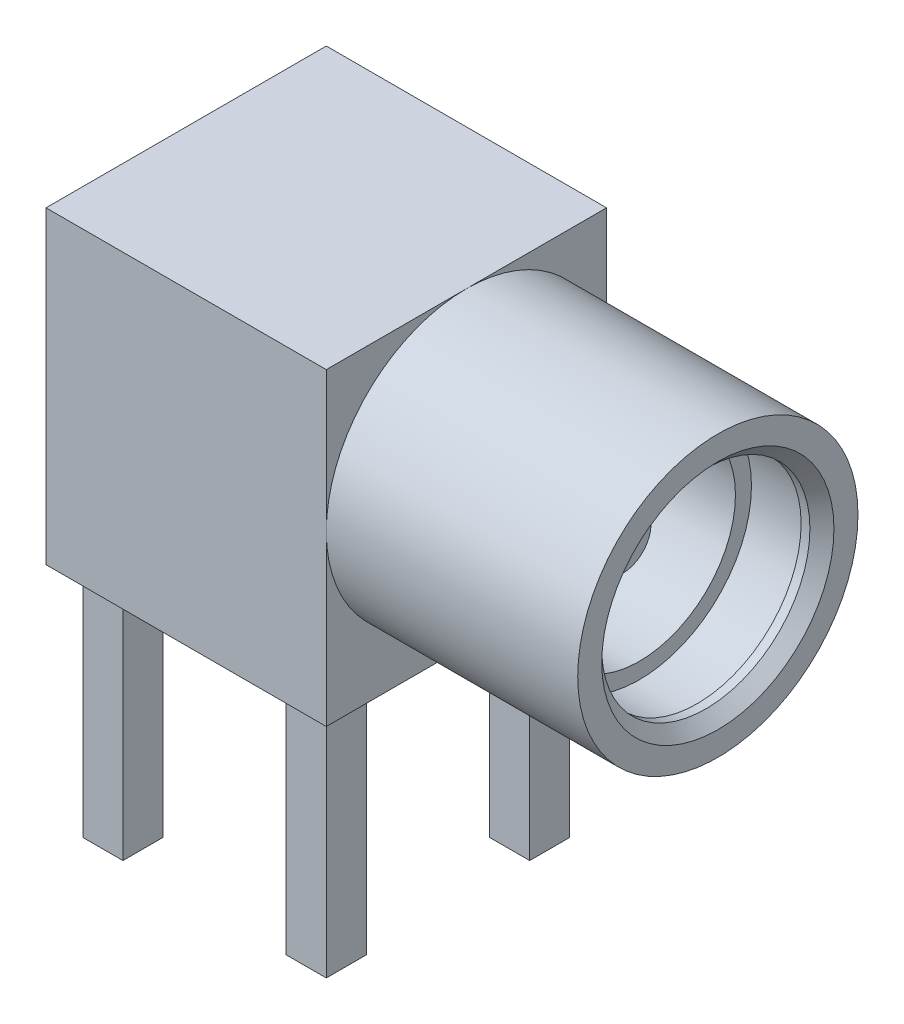
from build123d import *

# Parameters (mm, degrees)
SKETCH1_W                 = 3.5
SKETCH1_H                 = 3.86
BOSS_EXTRUDE1_DEPTH       = 3.5
SKETCH2_R                 = 1.75
BOSS_EXTRUDE2_DEPTH       = 3.14
SKETCH3_W                 = 0.5
SKETCH3_H                 = 0.5
BOSS_EXTRUDE3_DEPTH       = 2.95
SKETCH4_W                 = 0.5
SKETCH4_H                 = 0.5
BOSS_EXTRUDE4_DEPTH       = 2.95
SKETCH5_W                 = 0.5
SKETCH5_H                 = 0.5
BOSS_EXTRUDE5_DEPTH       = 2.95
SKETCH6_W                 = 0.5
SKETCH6_H                 = 0.5
BOSS_EXTRUDE6_DEPTH       = 2.95
F_2_CLEARANCE_HOLE1_D     = 2.4
F_2_CLEARANCE_HOLE1_DEPTH = 2.59
SKETCH11_W                = 1.4
SKETCH11_H                = 0.355


with BuildPart() as part:
    # Sketch1 → Boss-Extrude1 (new body)
    with BuildSketch(Plane(origin=(0, 0, 20.79), x_dir=(-1, 0, 0), z_dir=(0, 0, -1))):
        with Locations((-39.7625, -43.83)):
            Rectangle(SKETCH1_W, SKETCH1_H)
    extrude(amount=-BOSS_EXTRUDE1_DEPTH)

    # Sketch2 → Boss-Extrude2 (add)
    with BuildSketch(Plane(origin=(41.5125, 0, 0), x_dir=(0, 0, -1), z_dir=(1, 0, 0))):
        with Locations((-22.54, -43.65)):
            Circle(SKETCH2_R)
    extrude(amount=BOSS_EXTRUDE2_DEPTH)

    # Sketch3 → Boss-Extrude3 (add)
    with BuildSketch(Plane.XZ.offset(45.76)):
        with Locations((38.4925, 23.81)):
            Rectangle(SKETCH3_W, SKETCH3_H)
    extrude(amount=BOSS_EXTRUDE3_DEPTH)

    # Sketch4 → Boss-Extrude4 (add)
    with BuildSketch(Plane.XZ.offset(45.76)):
        with Locations((41.0325, 21.27)):
            Rectangle(SKETCH4_W, SKETCH4_H)
    extrude(amount=BOSS_EXTRUDE4_DEPTH)

    # Sketch5 → Boss-Extrude5 (add)
    with BuildSketch(Plane.XZ.offset(45.76)):
        with Locations((38.4925, 21.27)):
            Rectangle(SKETCH5_W, SKETCH5_H)
    extrude(amount=BOSS_EXTRUDE5_DEPTH)

    # Sketch6 → Boss-Extrude6 (add)
    with BuildSketch(Plane.XZ.offset(45.76)):
        with Locations((41.0325, 23.81)):
            Rectangle(SKETCH6_W, SKETCH6_H)
    extrude(amount=BOSS_EXTRUDE6_DEPTH)

    # #2 Clearance Hole1
    with Locations(Plane(origin=(44.6525, 0, 0), x_dir=(0, 0, -1), z_dir=(1, 0, 0))):
        with Locations((-22.54, -43.65)):
            Hole(F_2_CLEARANCE_HOLE1_D / 2, depth=F_2_CLEARANCE_HOLE1_DEPTH)

    # Sketch9 → Revolve1 (revolve)
    with BuildSketch(Plane.XY.offset(22.54)):
        Polygon((40.1175, -45.76), (39.7625, -45.76), (39.7625, -48.71), (39.9675, -48.71), (40.1175, -48.56), align=None)
    revolve(axis=Axis((39.7625, -45.76, 22.54), (0, -1, 0)))

    # Sketch10 → Cut-Revolve1 (revolve, cut)
    with BuildSketch(Plane.XY.offset(22.54), mode=Mode.PRIVATE) as cut_revolve1_sk:
        Polygon((44.6525, -42.45), (44.6525, -42.2), (44.5025, -42.35), (44.3925, -42.35), (44.3925, -42.25), (43.6725, -42.25), (43.6725, -42.45), align=None)
    revolve(cut_revolve1_sk.sketch.rotate(Axis((43.6725, -43.65, 22.54), (1, 0, 0)), 270), axis=Axis((43.6725, -43.65, 22.54), (1, 0, 0)), mode=Mode.SUBTRACT)

    # Sketch11 → Revolve2 (revolve)
    with BuildSketch(Plane.XY.offset(22.54), mode=Mode.PRIVATE) as revolve2_sk:
        with Locations((42.7625, -43.4725)):
            Rectangle(SKETCH11_W, SKETCH11_H)
    revolve(revolve2_sk.sketch.rotate(Axis((42.0625, -43.65, 22.54), (1, 0, 0)), 270), axis=Axis((42.0625, -43.65, 22.54), (1, 0, 0)))


solid = part.part
